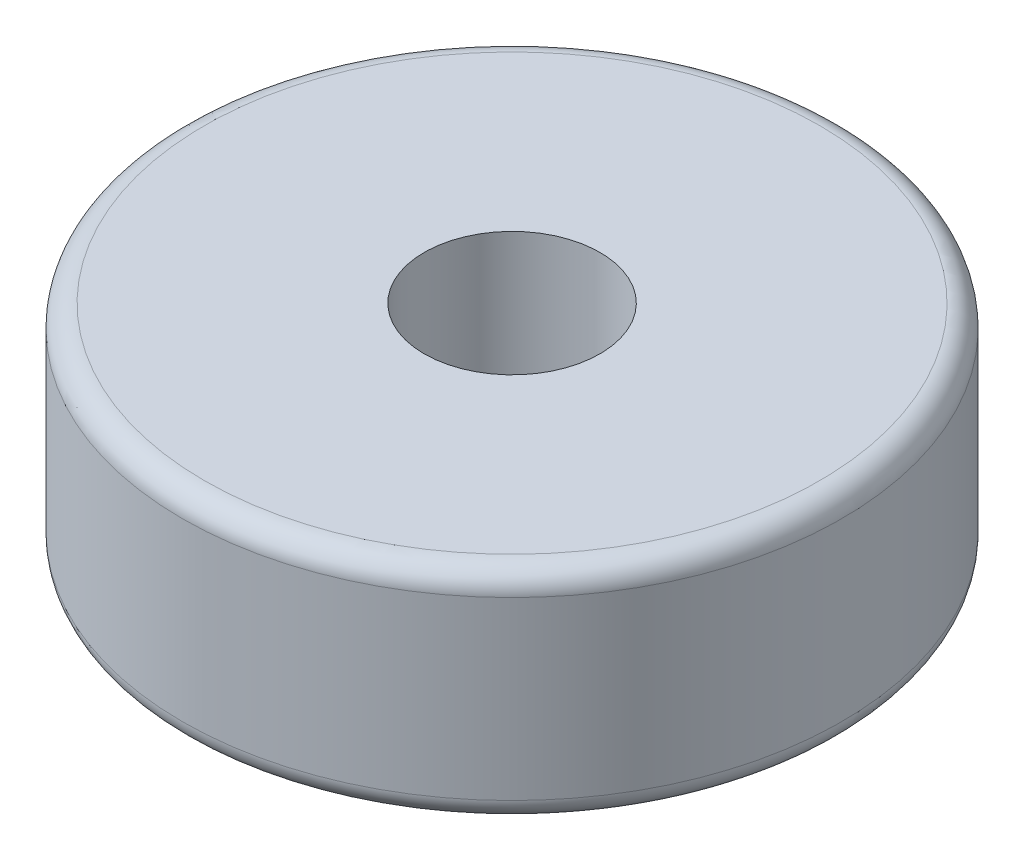
from build123d import *

# Parameters (mm, degrees)
SKETCH2_R           = 38.1
SKETCH2_R_2         = 10.16
BOSS_EXTRUDE1_DEPTH = 25.4
FILLET1_R           = 2.54


with BuildPart() as part:
    # Sketch2 → Boss-Extrude1 (new body)
    with BuildSketch(Plane(origin=(0, 0, 0), x_dir=(1, 0, 0), z_dir=(0, 1, 0))):
        with Locations(Location((0, 0, 0), (0, 0, 270))):
            Circle(SKETCH2_R)
        with Locations(Location((0, 0, 0), (0, 0, 270))):
            Circle(SKETCH2_R_2, mode=Mode.SUBTRACT)
    extrude(amount=BOSS_EXTRUDE1_DEPTH)

    # Fillet1
    fillet1_edges = [part.edges().sort_by_distance(p)[0] for p in [
        (0, 0, -38.1),
        (0, 25.4, -38.1),
    ]]
    fillet(fillet1_edges, radius=FILLET1_R)


solid = part.part
